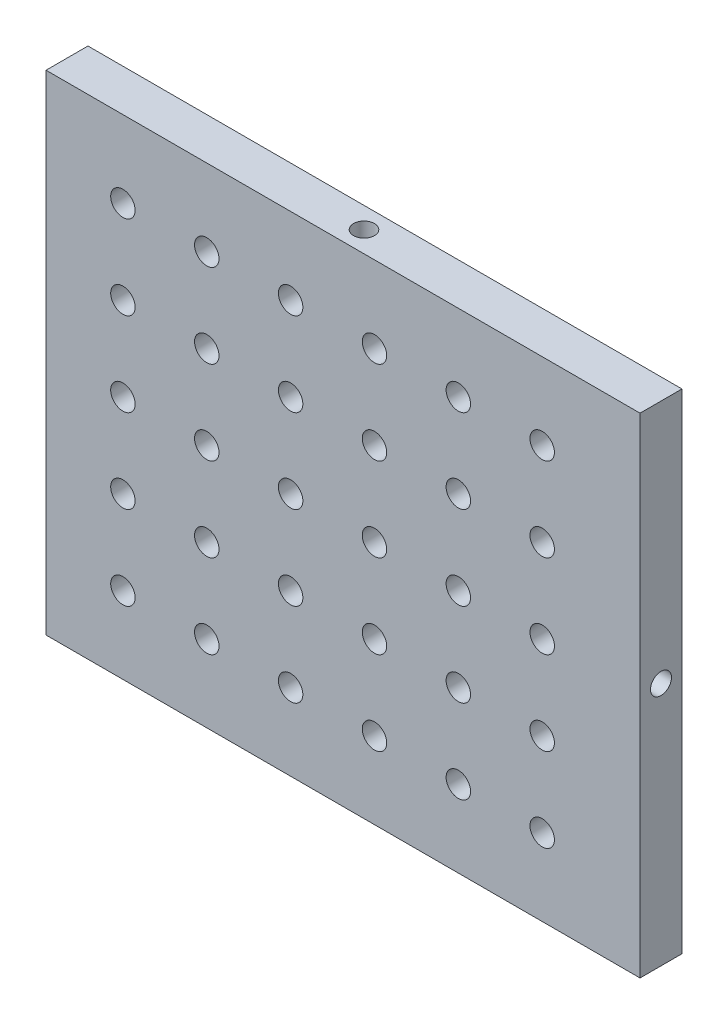
from build123d import *

# Parameters (mm, degrees)
ESQUISSE1_W                     = 85
ESQUISSE1_H                     = 70
BOSS_EXTRU_1_DEPTH              = 6
ESQUISSE3_R                     = 1.5
ENL_V_MAT_EXTRU_5_DEPTH         = 5
ESQUISSE5_R                     = 1.75
ENL_V_MAT_EXTRU_6_DEPTH         = 6
R_P_TITION_LIN_AIRE2_COUNT      = 6
R_P_TITION_LIN_AIRE2_PITCH      = 12
R_P_TITION_LIN_AIRE2_COUNT_DIR2 = 5
R_P_TITION_LIN_AIRE2_PITCH_DIR2 = 12
ESQUISSE8_R                     = 1.5
ENL_V_MAT_EXTRU_8_DEPTH         = 5


with BuildPart() as part:
    # Esquisse1 → Boss.-Extru.1 (new body)
    with BuildSketch(Plane.XY):
        Rectangle(ESQUISSE1_W, ESQUISSE1_H)
    extrude(amount=BOSS_EXTRU_1_DEPTH)

    # Esquisse3 → Enlèv. mat.-Extru.5 (cut)
    with BuildSketch(Plane.ZY.offset(42.5)):
        with Locations((3, 0)):
            Circle(ESQUISSE3_R)
    enl_v_mat_extru_5 = extrude(amount=-ENL_V_MAT_EXTRU_5_DEPTH, mode=Mode.SUBTRACT)

    # Symétrie1: Enlèv. mat.-Extru.5 across plane
    add(enl_v_mat_extru_5.mirror(Plane(origin=(0, 0, 0), x_dir=(0, 0, 1), z_dir=(1, 0, 0))), mode=Mode.SUBTRACT)

    # Esquisse5 → Enlèv. mat.-Extru.6 (cut)
    with BuildSketch(Plane.XY):
        with Locations(Location((-31.5, -24, 0), (0, 0, 180))):
            Circle(ESQUISSE5_R)
    enl_v_mat_extru_6 = extrude(amount=ENL_V_MAT_EXTRU_6_DEPTH, mode=Mode.SUBTRACT)

    # Répétition linéaire2: Enl_v. mat.-Extru.6 6 × 5
    with Locations(*[(i * R_P_TITION_LIN_AIRE2_PITCH, j * R_P_TITION_LIN_AIRE2_PITCH_DIR2, 0) for i in range(R_P_TITION_LIN_AIRE2_COUNT) for j in range(R_P_TITION_LIN_AIRE2_COUNT_DIR2) if (i, j) != (0, 0)]):
        add(enl_v_mat_extru_6, mode=Mode.SUBTRACT)

    # Esquisse8 → Enlèv. mat.-Extru.8 (cut)
    with BuildSketch(Plane(origin=(0, 35, 0), x_dir=(1, 0, 0), z_dir=(0, 1, 0))):
        with Locations(Location((0, -3, 0), (0, 0, 270))):
            Circle(ESQUISSE8_R)
    enl_v_mat_extru_8 = extrude(amount=-ENL_V_MAT_EXTRU_8_DEPTH, mode=Mode.SUBTRACT)

    # Symétrie2: Enlèv. mat.-Extru.8 across plane
    add(enl_v_mat_extru_8.mirror(Plane.ZX), mode=Mode.SUBTRACT)


solid = part.part
